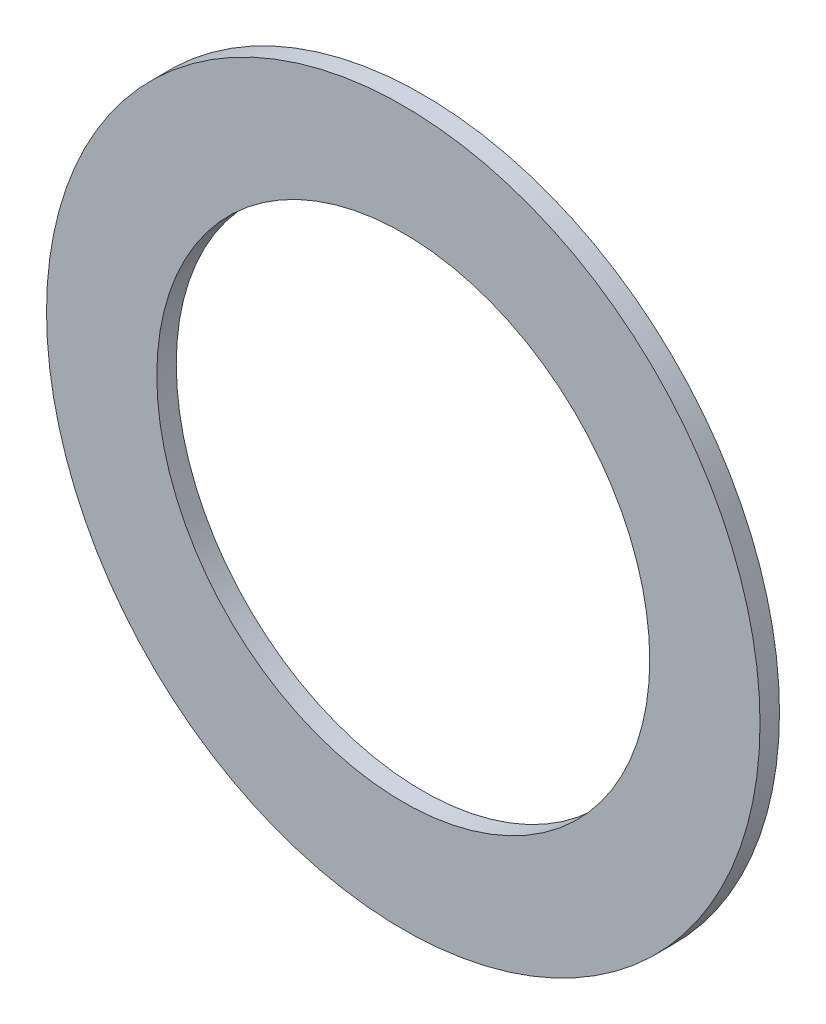
from build123d import *

# Parameters (mm, degrees)
SKIZZE1_R                       = 27.5
SKIZZE1_R_2                     = 19
AUFSATZ_LINEAR_AUSTRAGEN1_DEPTH = 0.75


with BuildPart() as part:
    # Skizze1 → Aufsatz-Linear austragen1 (new, symmetric)
    with BuildSketch(Plane.XY):
        Circle(SKIZZE1_R)
        Circle(SKIZZE1_R_2, mode=Mode.SUBTRACT)
    extrude(amount=AUFSATZ_LINEAR_AUSTRAGEN1_DEPTH, both=True)


solid = part.part
